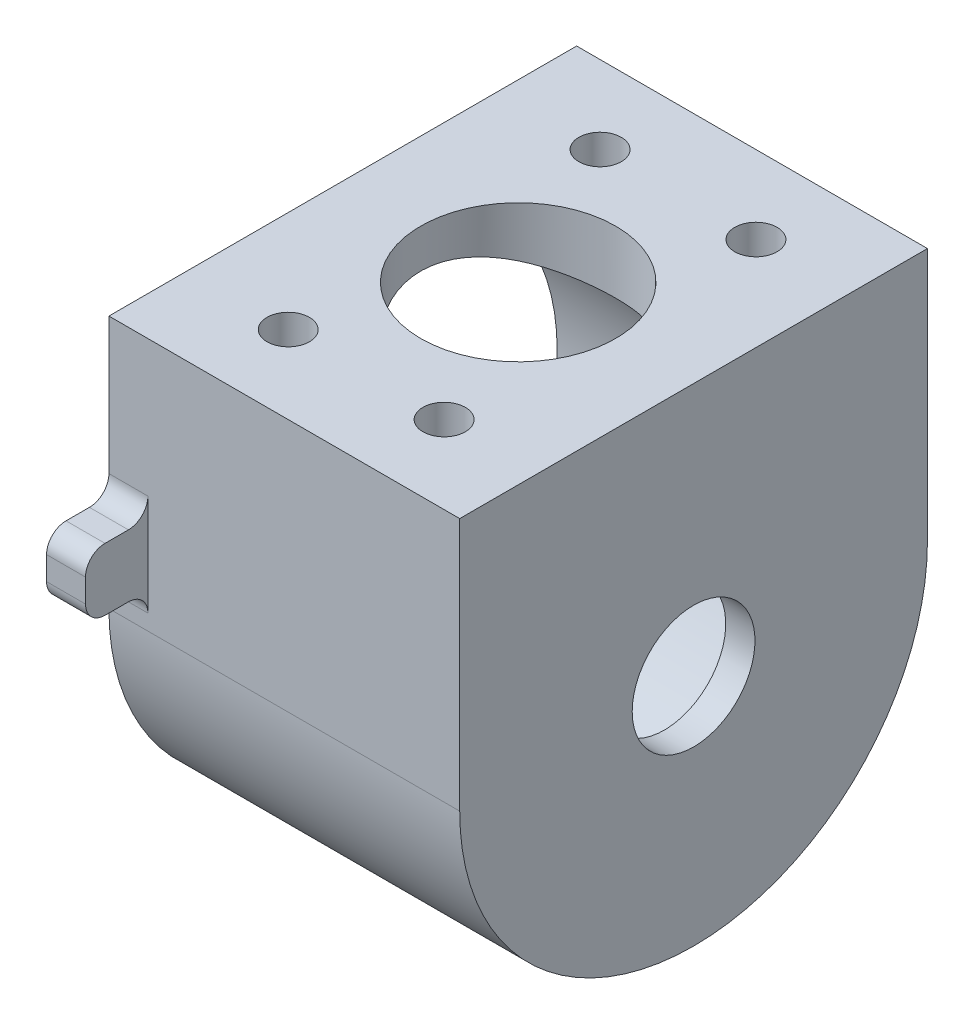
from build123d import *

# Parameters (mm, degrees)
BOSS_EXTRUDE1_DEPTH       = 28.575
SKETCH2_R                 = 17.4625
CUT_EXTRUDE1_DEPTH        = 26.19375
SKETCH3_R                 = 5
CUT_EXTRUDE2_DEPTH        = 39.404706031
F_8_32_TAPPED_HOLE1_D     = 3.4544
F_8_32_TAPPED_HOLE1_DEPTH = 5.588
F_8_32_TAPPED_HOLE1_TIP   = 1.037806461
SKETCH6_W                 = 5.08
SKETCH6_H                 = 5.08
BOSS_EXTRUDE2_DEPTH       = 3.175
FILLET1_R                 = 1.5875
CUT_EXTRUDE3_REACH        = 56.533
CUT_EXTRUDE3_END_RADIUS   = 17.4625
SKETCH7_R                 = 7.9375


with BuildPart() as part:
    # Sketch1 → Boss-Extrude1 (new body)
    with BuildSketch(Plane(origin=(0, 0, 0), x_dir=(0, 0, -1), z_dir=(1, 0, 0))):
        with BuildLine():
            Line((-19.05, 0), (-19.05, 20.6375))
            Line((-19.05, 20.6375), (19.05, 20.6375))
            Line((19.05, 20.6375), (19.05, 0))
            ThreePointArc((19.05, 0), (0, -19.05), (-19.05, 0))
        make_face()
    extrude(amount=BOSS_EXTRUDE1_DEPTH)

    # Sketch2 → Cut-Extrude1 (cut)
    with BuildSketch(Plane.ZY):
        Circle(SKETCH2_R)
    extrude(amount=-CUT_EXTRUDE1_DEPTH, mode=Mode.SUBTRACT)

    # Sketch3 → Cut-Extrude2 (cut, through all)
    with BuildSketch(Plane.ZY.offset(-26.19375)):
        Circle(SKETCH3_R)
    extrude(amount=-CUT_EXTRUDE2_DEPTH, mode=Mode.SUBTRACT)

    # #8-32 Tapped Hole1
    with Locations(Plane(origin=(0, 20.6375, 0), x_dir=(-1, 0, 0), z_dir=(0, 1, 0))):
        with Locations((-8.255, 12.7), (-8.255, -12.7), (-20.955, -12.7), (-20.955, 12.7), (-34.258152115, 14.428229267)):
            Hole(F_8_32_TAPPED_HOLE1_D / 2, depth=F_8_32_TAPPED_HOLE1_DEPTH)
            with Locations((0, 0, -(F_8_32_TAPPED_HOLE1_DEPTH + F_8_32_TAPPED_HOLE1_TIP / 2))):  # 118° drill point
                Cone(0, F_8_32_TAPPED_HOLE1_D / 2, F_8_32_TAPPED_HOLE1_TIP, mode=Mode.SUBTRACT)

    # Sketch6 → Boss-Extrude2 (add)
    with BuildSketch(Plane.ZY):
        with Locations((-21.59, 5.3975)):
            Rectangle(SKETCH6_W, SKETCH6_H)
    boss_extrude2 = extrude(amount=-BOSS_EXTRUDE2_DEPTH)

    # Mirror1: Boss-Extrude2 across plane
    add(boss_extrude2.mirror(Plane.XY))

    # Fillet1
    fillet1_edges = [part.edges().sort_by_distance(p)[0] for p in [
        (1.5875, 7.9375, -19.05),
        (1.5875, 2.8575, -19.05),
        (1.5875, 2.8575, -24.13),
        (1.5875, 7.9375, -24.13),
        (1.5875, 2.8575, 19.05),
        (1.5875, 7.9375, 19.05),
        (1.5875, 7.9375, 24.13),
        (1.5875, 2.8575, 24.13),
    ]]
    fillet(fillet1_edges, radius=FILLET1_R)

    # Cut-Extrude3: up to this cylinder (the profile starts outside it)
    cut_extrude3_end = Plane(origin=(14.2875, 0, 0), z_dir=(-1, 0, 0)) * Cylinder(CUT_EXTRUDE3_END_RADIUS, 148.991, mode=Mode.PRIVATE)
    # Sketch7 → Cut-Extrude3 (cut, up to the surface)
    with BuildSketch(Plane(origin=(0, 20.6375, 0), x_dir=(1, 0, 0), z_dir=(0, 1, 0)), mode=Mode.PRIVATE) as cut_extrude3_sk1:
        with Locations(Location((14.2875, 0, 0), (0, 0, 270))):
            Circle(SKETCH7_R)
    cut_extrude3_tool1 = extrude(cut_extrude3_sk1.sketch, amount=-CUT_EXTRUDE3_REACH, mode=Mode.PRIVATE) - cut_extrude3_end
    add(cut_extrude3_tool1.solids().sort_by_distance((14.2875, 20.6375, 0))[0], mode=Mode.SUBTRACT)


solid = part.part
